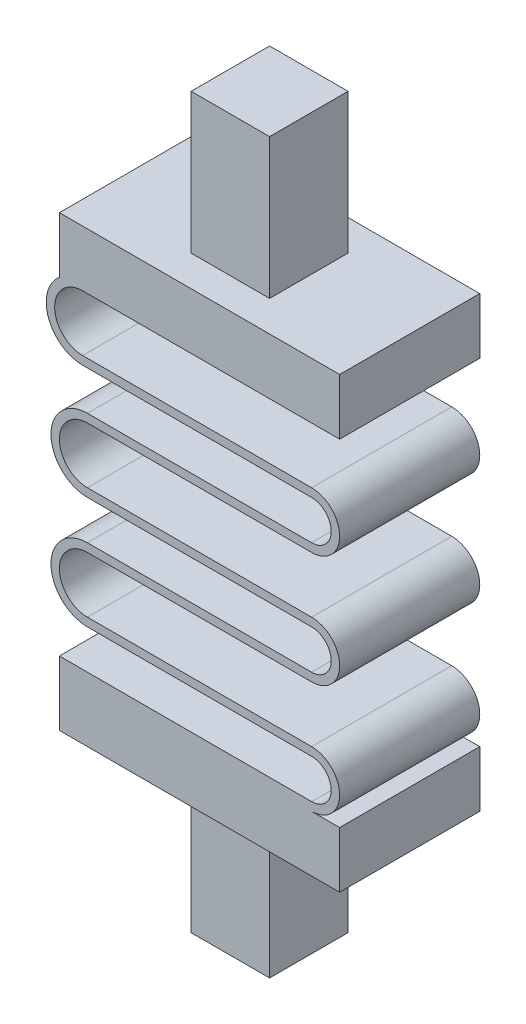
from build123d import *

# Parameters (mm, degrees)
BOSS_EXTRUDE1_DEPTH = 5
SKETCH3_W           = 2.8
SKETCH3_H           = 2.8
BOSS_EXTRUDE2_DEPTH = 5
SKETCH4_W           = 2.8
SKETCH4_H           = 2.8
BOSS_EXTRUDE3_DEPTH = 5


with BuildPart() as part:
    # Sketch2 → Boss-Extrude1 (new body)
    with BuildSketch(Plane.XY):
        with BuildLine():
            Line((4, 2.573223097), (-4.169337614, 2.573223097))
            ThreePointArc((-4.169337614, 2.573223097), (-5.169337614, 3.573223097), (-4.169337614, 4.573223097))
            Line((-4.169337614, 4.573223097), (-5, 4.573223097))
            ThreePointArc((-5, 4.573223097), (-5.39203954, 3.131635053), (-4.169337614, 2.273223097))
            Line((-4.169337614, 2.273223097), (4, 2.273223097))
            ThreePointArc((4, 2.273223097), (4.7, 1.573223097), (4, 0.873223097))
            Line((4, 0.873223097), (-4, 0.873223097))
            ThreePointArc((-4, 0.873223097), (-5.3, -0.426776903), (-4, -1.726776903))
            Line((-4, -1.726776903), (4, -1.726776903))
            ThreePointArc((4, -1.726776903), (4.7, -2.426776903), (4, -3.126776903))
            Line((4, -3.126776903), (-4, -3.126776903))
            ThreePointArc((-4, -3.126776903), (-5.3, -4.426776903), (-4, -5.726776903))
            Line((-4, -5.726776903), (4, -5.726776903))
            ThreePointArc((4, -5.726776903), (4.7, -6.426776903), (4, -7.126776903))
            Line((4, -7.126776903), (-5, -7.126776903))
            Line((-5, -7.126776903), (-5, -7.426776903))
            Line((-5, -7.426776903), (4, -7.426776903))
            ThreePointArc((4, -7.426776903), (5, -6.426776903), (4, -5.426776903))
            Line((4, -5.426776903), (-4, -5.426776903))
            ThreePointArc((-4, -5.426776903), (-5, -4.426776903), (-4, -3.426776903))
            Line((-4, -3.426776903), (4, -3.426776903))
            ThreePointArc((4, -3.426776903), (5, -2.426776903), (4, -1.426776903))
            Line((4, -1.426776903), (-4, -1.426776903))
            ThreePointArc((-4, -1.426776903), (-5, -0.426776903), (-4, 0.573223097))
            Line((-4, 0.573223097), (4, 0.573223097))
            ThreePointArc((4, 0.573223097), (5, 1.573223097), (4, 2.573223097))
        make_face()
        Polygon((-5, 4.573223097), (-4.169337614, 4.573223097), (5, 4.573223097), (5, 6.573223097), (-5, 6.573223097), align=None)
        Polygon((5, -7.426776903), (4, -7.426776903), (-5, -7.426776903), (-5, -9.426776903), (5, -9.426776903), align=None)
    extrude(amount=BOSS_EXTRUDE1_DEPTH)

    # Sketch3 → Boss-Extrude2 (add)
    with BuildSketch(Plane(origin=(0, 6.573223097, 0), x_dir=(1, 0, 0), z_dir=(0, 1, 0))):
        with Locations((0, -2.5)):
            Rectangle(SKETCH3_W, SKETCH3_H)
    extrude(amount=BOSS_EXTRUDE2_DEPTH)

    # Sketch4 → Boss-Extrude3 (add)
    with BuildSketch(Plane.XZ.offset(9.426776903)):
        with Locations((0, 2.5)):
            Rectangle(SKETCH4_W, SKETCH4_H)
    extrude(amount=BOSS_EXTRUDE3_DEPTH)


solid = part.part
